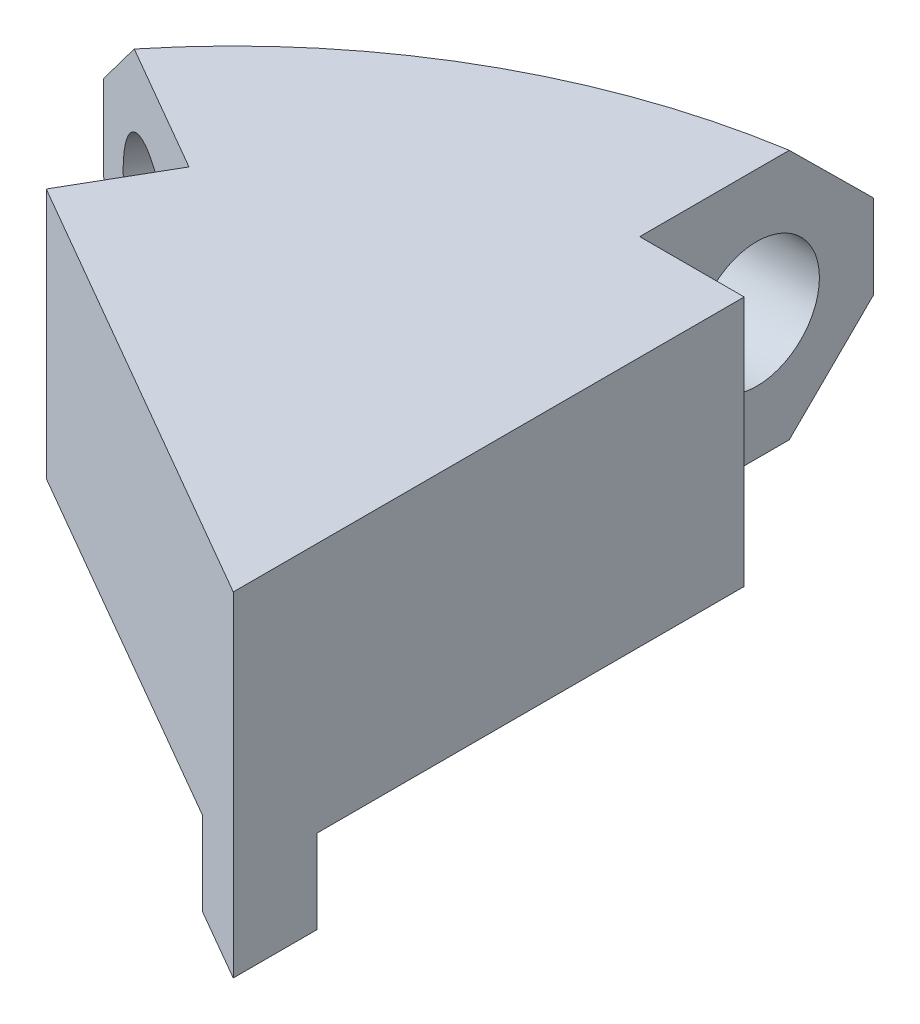
from build123d import *

# Parameters (mm, degrees)
SALIENTE_EXTRUIR1_DEPTH = 15
CORTAR_EXTRUIR2_DEPTH   = 30
CROQUIS4_R              = 7.5
CORTAR_EXTRUIR3_DEPTH   = 13
CROQUIS5_R              = 7.5
CORTAR_EXTRUIR4_DEPTH   = 13
SALIENTE_EXTRUIR2_DEPTH = 10
CHAFL_N1_SIZE           = 10
CHAFL_N2_SIZE           = 10


with BuildPart() as part:
    # Croquis1 → Saliente-Extruir1 (new, symmetric)
    with BuildSketch(Plane(origin=(0, 0, 0), x_dir=(1, 0, 0), z_dir=(0, 1, 0))):
        with BuildLine():
            Line((-136.742226614, -20.094724465), (-112.493515308, -6.094724465))
            Line((-112.493515308, -6.094724465), (-118.743515308, 4.730593082))
            Line((-118.743515308, 4.730593082), (-124.993515308, 15.55591063))
            Line((-124.993515308, 15.55591063), (-149.242226614, 1.55591063))
            ThreePointArc((-149.242226614, 1.55591063), (-155.805359207, 35.294451757), (-149.242226614, 69.032992885))
            Line((-149.242226614, 69.032992885), (-124.993515308, 55.032992885))
            Line((-124.993515308, 55.032992885), (-118.743515308, 65.858310432))
            Line((-118.743515308, 65.858310432), (-112.493515308, 76.68362798))
            Line((-112.493515308, 76.68362798), (-136.742226614, 90.68362798))
            ThreePointArc((-136.742226614, 90.68362798), (-110.805359207, 113.236738098), (-78.305359207, 124.422169107))
            Line((-78.305359207, 124.422169107), (-78.305359207, 96.422169107))
            Line((-78.305359207, 96.422169107), (-65.805359207, 96.422169107))
            Line((-65.805359207, 96.422169107), (-53.305359207, 96.422169107))
            Line((-53.305359207, 96.422169107), (-53.305359207, 124.422169107))
            ThreePointArc((-53.305359207, 124.422169107), (-20.805359207, 113.236738098), (5.131508199, 90.68362798))
            Line((5.131508199, 90.68362798), (-19.117203107, 76.68362798))
            Line((-19.117203107, 76.68362798), (-6.617203107, 55.032992885))
            Line((-6.617203107, 55.032992885), (17.631508199, 69.032992885))
            ThreePointArc((17.631508199, 69.032992885), (24.194640793, 35.294451757), (17.631508199, 1.55591063))
            Line((17.631508199, 1.55591063), (-6.617203107, 15.55591063))
            Line((-6.617203107, 15.55591063), (-12.867203107, 4.730593082))
            Line((-12.867203107, 4.730593082), (-19.117203107, -6.094724465))
            Line((-19.117203107, -6.094724465), (5.131508199, -20.094724465))
            ThreePointArc((5.131508199, -20.094724465), (-20.805359207, -42.647834583), (-53.305359207, -53.833265593))
            Line((-53.305359207, -53.833265593), (-53.305359207, -25.833265593))
            Line((-53.305359207, -25.833265593), (-65.805359207, -25.833265593))
            Line((-65.805359207, -25.833265593), (-78.305359207, -25.833265593))
            Line((-78.305359207, -25.833265593), (-78.305359207, -53.833265593))
            ThreePointArc((-78.305359207, -53.833265593), (-110.805359207, -42.647834583), (-136.742226614, -20.094724465))
        make_face()
    extrude(amount=SALIENTE_EXTRUIR1_DEPTH, both=True)

    # Croquis3 → Cortar-Extruir2 (cut)
    with BuildSketch(Plane(origin=(0, 15, 0), x_dir=(1, 0, 0), z_dir=(0, 1, 0))):
        with BuildLine():
            Line((-65.805359207, 96.422169107), (-65.805359207, 35.294451757))
            Line((-65.805359207, 35.294451757), (-118.743515308, 65.858310432))
            Line((-118.743515308, 65.858310432), (-112.493515308, 76.68362798))
            Line((-112.493515308, 76.68362798), (-136.742226614, 90.68362798))
            ThreePointArc((-136.742226614, 90.68362798), (-20.805359207, -42.647834583), (-78.305359207, 124.422169107))
            Line((-78.305359207, 124.422169107), (-78.305359207, 96.422169107))
            Line((-78.305359207, 96.422169107), (-65.805359207, 96.422169107))
        make_face()
    extrude(amount=-CORTAR_EXTRUIR2_DEPTH, mode=Mode.SUBTRACT)

    # Croquis4 → Cortar-Extruir3 (cut)
    with BuildSketch(Plane(origin=(-78.305359207, 0, 0), x_dir=(0, 0, -1), z_dir=(1, 0, 0))):
        with Locations((110.422169107, 0)):
            Circle(CROQUIS4_R)
    extrude(amount=-CORTAR_EXTRUIR3_DEPTH, mode=Mode.SUBTRACT)

    # Croquis5 → Cortar-Extruir4 (cut)
    with BuildSketch(Plane(origin=(5.081606115, 0, -8.801599976), x_dir=(0.8660254037844403, 0, 0.4999999999999971), z_dir=(-0.49999999999999717, 0, 0.8660254037844404))):
        with Locations((-149.764056007, 0)):
            Circle(CROQUIS5_R)
    extrude(amount=-CORTAR_EXTRUIR4_DEPTH, mode=Mode.SUBTRACT)

    # Croquis6 → Saliente-Extruir2 (add)
    with BuildSketch(Plane.XZ.offset(15)):
        with BuildLine():
            Line((-65.805359207, -35.294451757), (-74.465613245, -40.294451757))
            ThreePointArc((-74.465613245, -40.294451757), (-70.805359207, -43.954705795), (-65.805359207, -45.294451757))
            Line((-65.805359207, -45.294451757), (-65.805359207, -35.294451757))
        make_face()
    extrude(amount=SALIENTE_EXTRUIR2_DEPTH)

    # Chaflán1
    chafl_n1_edges = [part.edges().sort_by_distance(p)[0] for p in [
        (-110.805359207, -15, -113.236738098),
    ]]
    chamfer(chafl_n1_edges, length=CHAFL_N1_SIZE)

    # Chaflán2
    chafl_n2_edges = [part.edges().sort_by_distance(p)[0] for p in [
        (-110.805359207, 15, -113.236738098),
    ]]
    chamfer(chafl_n2_edges, length=CHAFL_N2_SIZE)


solid = part.part
